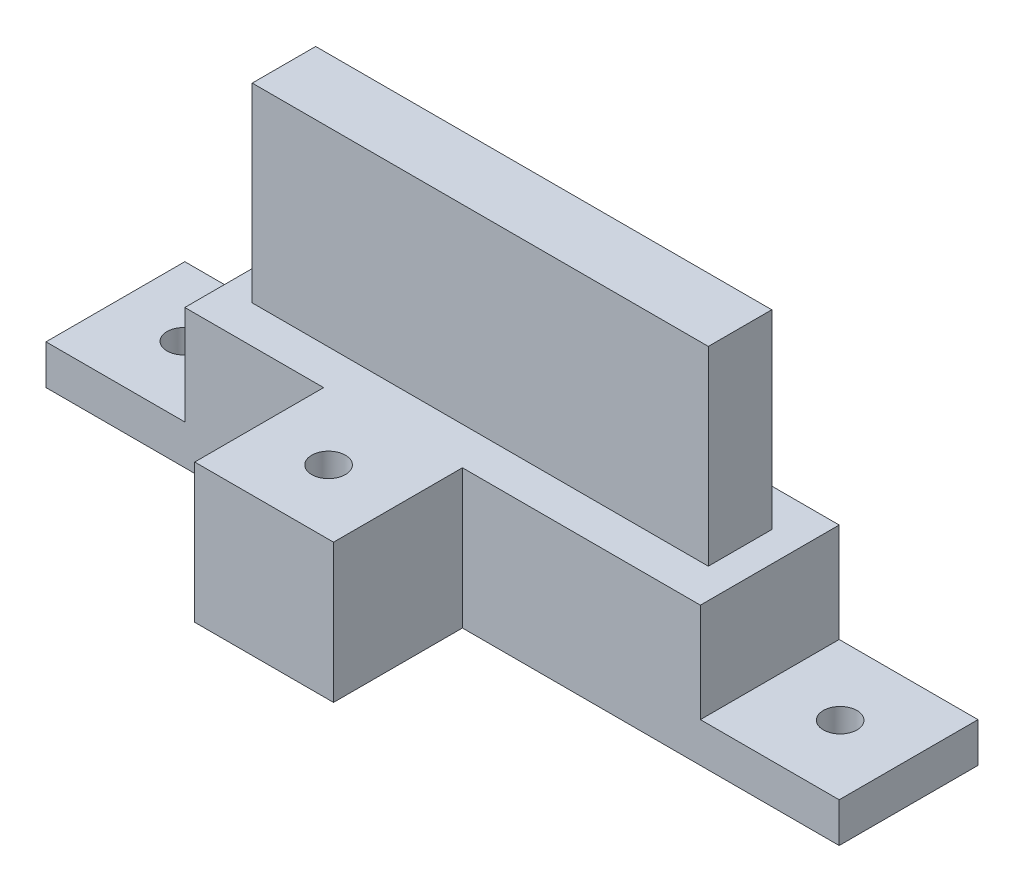
from build123d import *

# Parameters (mm, degrees)
BOSS_EXTRUDE1_DEPTH = 17.5
SKETCH4_OUTSIDE_W   = 245.87
SKETCH4_OUTSIDE_H   = 80.87
SKETCH4_OUTSIDE_W_2 = 115
SKETCH4_OUTSIDE_H_2 = 16
CUT_EXTRUDE1_DEPTH  = 48
SKETCH5_W           = 35
SKETCH5_H           = 35
BOSS_EXTRUDE2_DEPTH = 50
SKETCH6_R           = 4.25
CUT_EXTRUDE2_DEPTH  = 122.671689394


with BuildPart() as part:
    # Sketch1 → Boss-Extrude1 (new, symmetric)
    with BuildSketch(Plane.XY):
        Polygon((-100, 0), (100, 0), (100, 10), (65, 10), (65, 35), (57.5, 35), (57.5, 83), (-57.5, 83), (-57.5, 35), (-65, 35), (-65, 10), (-100, 10), align=None)
    extrude(amount=BOSS_EXTRUDE1_DEPTH, both=True)

    # Sketch4 outside → Cut-Extrude1 (cut)
    with BuildSketch(Plane(origin=(0, 83, 0), x_dir=(1, 0, 0), z_dir=(0, 1, 0))):
        Rectangle(SKETCH4_OUTSIDE_W, SKETCH4_OUTSIDE_H)
        Rectangle(SKETCH4_OUTSIDE_W_2, SKETCH4_OUTSIDE_H_2, mode=Mode.SUBTRACT)
    extrude(amount=-CUT_EXTRUDE1_DEPTH, mode=Mode.SUBTRACT)

    # Sketch5 → Boss-Extrude2 (add, symmetric)
    with BuildSketch(Plane.XY):
        with Locations((-12.5, 17.5)):
            Rectangle(SKETCH5_W, SKETCH5_H)
    extrude(amount=BOSS_EXTRUDE2_DEPTH, both=True)

    # Sketch6 → Cut-Extrude2 (cut, through all)
    with BuildSketch(Plane(origin=(0, 35, 0), x_dir=(1, 0, 0), z_dir=(0, 1, 0))):
        with Locations(Location((-12.5, -33.75, 0), (0, 0, 270))):
            Circle(SKETCH6_R)
        with Locations(Location((-82.75, 0, 0), (0, 0, 270))):
            Circle(SKETCH6_R)
        with Locations(Location((82.75, 0, 0), (0, 0, 270))):
            Circle(SKETCH6_R)
        with Locations(Location((-12.5, 33.75, 0), (0, 0, 90))):
            Circle(SKETCH6_R)
    extrude(amount=-CUT_EXTRUDE2_DEPTH, mode=Mode.SUBTRACT)


solid = part.part
